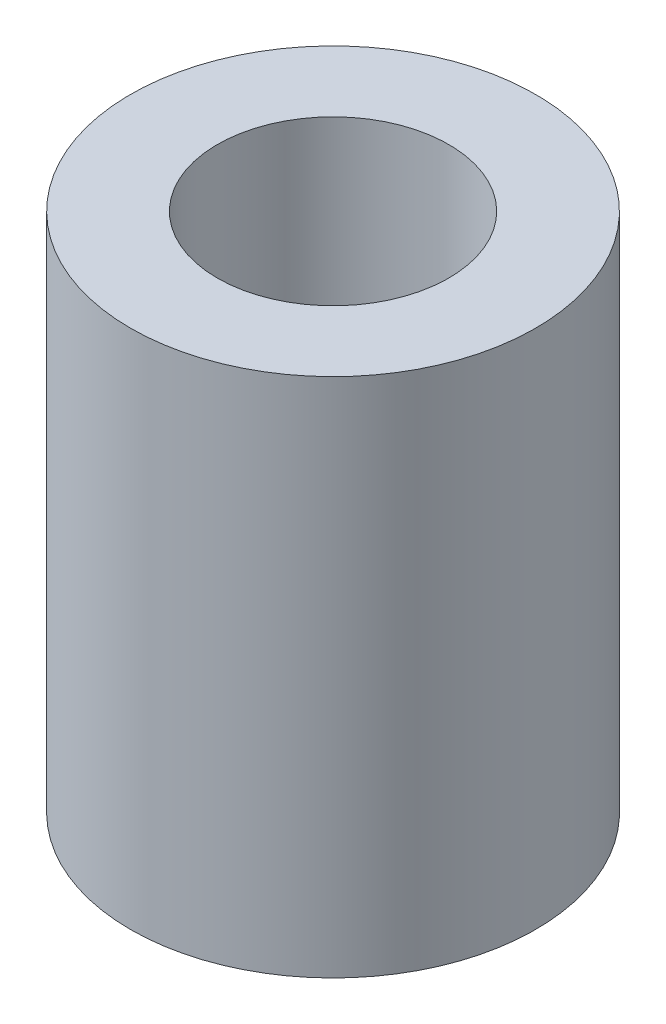
from build123d import *

# Parameters (mm, degrees)
SKETCH1_R           = 4.445
SKETCH1_R_2         = 2.54
BOSS_EXTRUDE1_DEPTH = 11.43


with BuildPart() as part:
    # Sketch1 → Boss-Extrude1 (new body)
    with BuildSketch(Plane(origin=(0, 0, 0), x_dir=(1, 0, 0), z_dir=(0, 1, 0))):
        with Locations(Location((0, 0, 0), (0, 0, 270))):
            Circle(SKETCH1_R)
        with Locations(Location((0, 0, 0), (0, 0, 270))):
            Circle(SKETCH1_R_2, mode=Mode.SUBTRACT)
    extrude(amount=BOSS_EXTRUDE1_DEPTH)


solid = part.part
